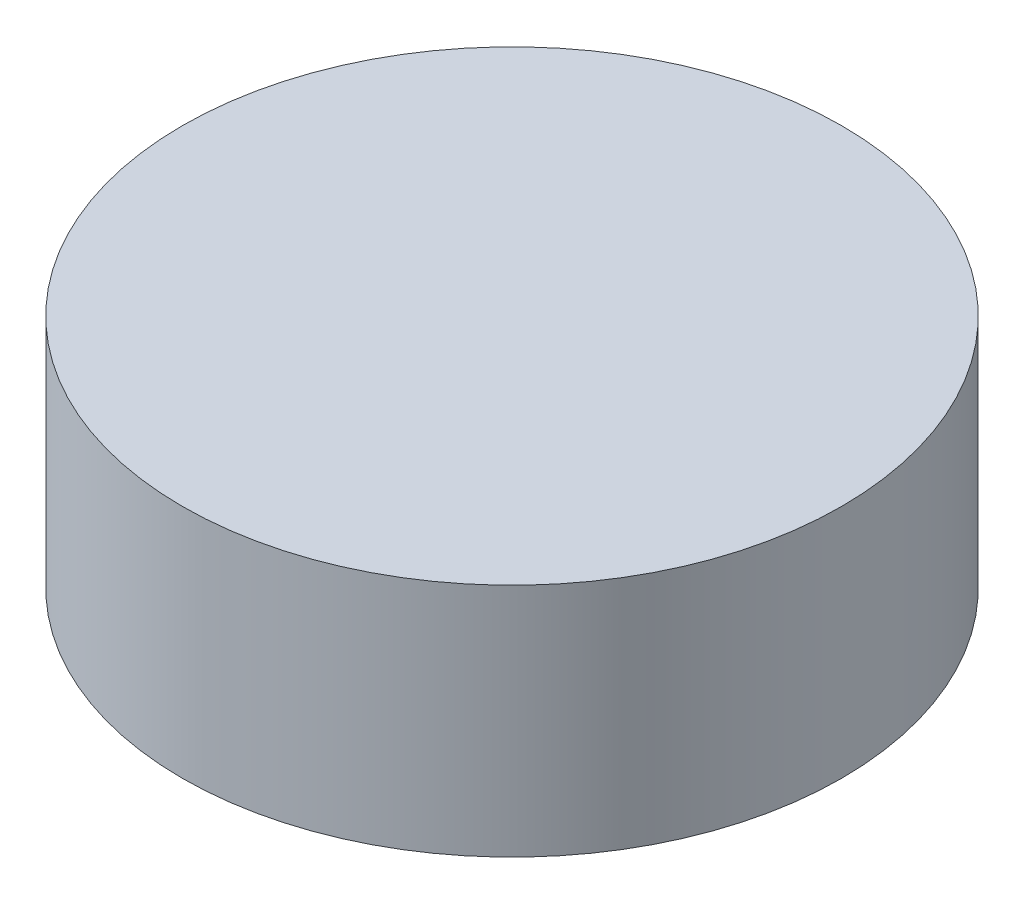
from build123d import *

# Parameters (mm, degrees)
SKETCH1_R           = 28
BOSS_EXTRUDE1_DEPTH = 20
SCALE1_SCALE        = 0.650078841


with BuildPart() as part:
    # Sketch1 → Boss-Extrude1 (new body)
    with BuildSketch(Plane(origin=(0, 0, 0), x_dir=(1, 0, 0), z_dir=(0, 1, 0))):
        with Locations(Location((0, 0, 0), (0, 0, 270))):
            Circle(SKETCH1_R)
    extrude(amount=BOSS_EXTRUDE1_DEPTH)


with BuildPart() as part_1:
    # Scale1: scaled about (0, 10, 0)
    add(part.part.scale(SCALE1_SCALE).moved(Location((0, 3.499211586, 0))))


solid = part_1.part
